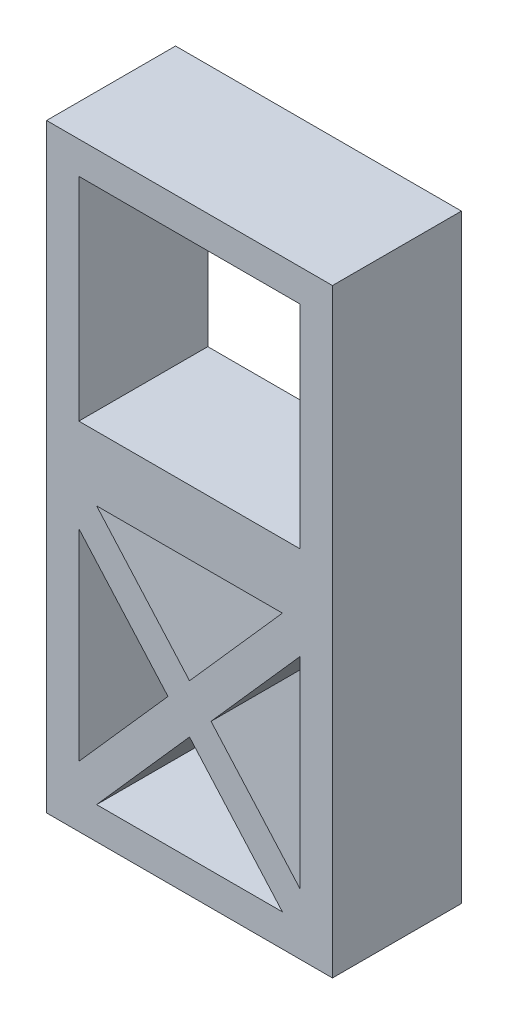
from build123d import *

# Parameters (mm, degrees)
SKETCH1_W           = 43.599999922
SKETCH1_H           = 41.750000066
BOSS_EXTRUDE1_DEPTH = 25.4


with BuildPart() as part:
    # Sketch1 → Boss-Extrude1 (new body)
    with BuildSketch(Plane.XY):
        Polygon((-28.149999961, -27.225000033), (-28.149999961, 27.225000033), (28.149999961, 27.225000033), (28.149999961, -27.225000033), (28.149999961, -90.874999987), (-28.149999961, -90.874999987), align=None)
        Rectangle(SKETCH1_W, SKETCH1_H, mode=Mode.SUBTRACT)
        Polygon((-18.29445374, -33.575000033), (0, -54.257806095), (18.29445374, -33.575000033), align=None, mode=Mode.SUBTRACT)
        Polygon((21.799999961, -39.1961904), (4.238814096, -59.05000001), (21.799999961, -78.90380962), align=None, mode=Mode.SUBTRACT)
        Polygon((-4.238814096, -59.05000001), (-21.799999961, -78.90380962), (-21.799999961, -39.1961904), align=None, mode=Mode.SUBTRACT)
        Polygon((0, -63.842193925), (-18.29445374, -84.524999987), (18.29445374, -84.524999987), align=None, mode=Mode.SUBTRACT)
    extrude(amount=BOSS_EXTRUDE1_DEPTH)


solid = part.part
